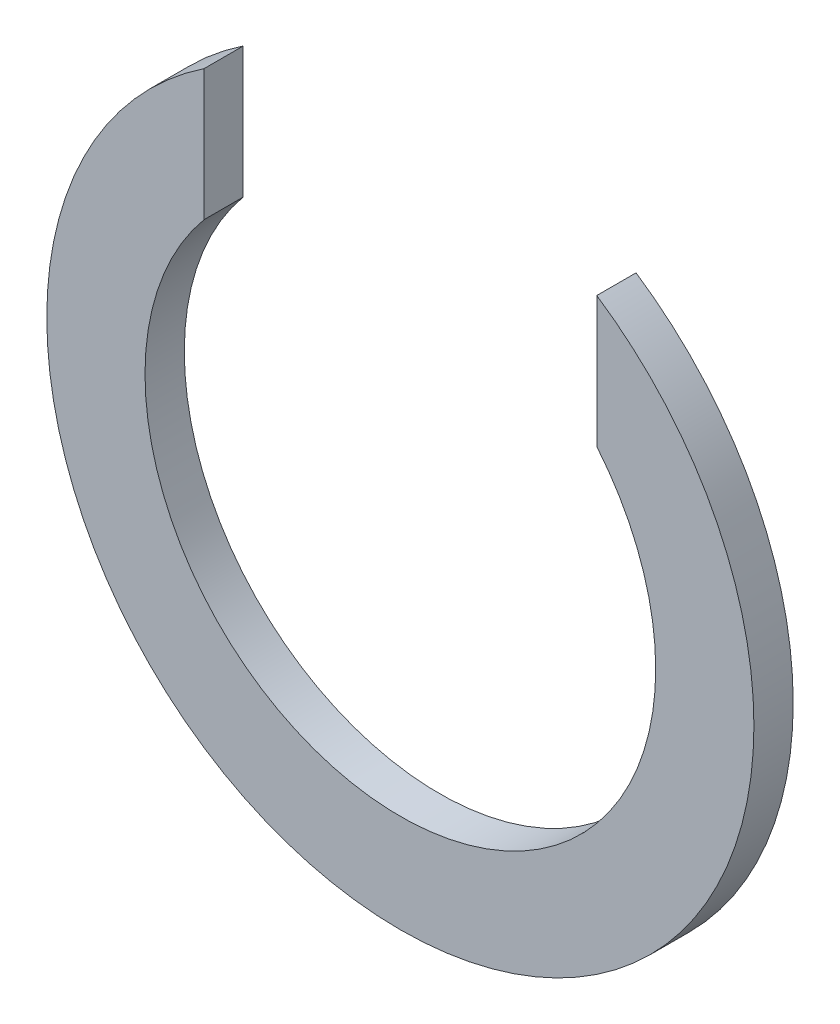
from build123d import *

# Parameters (mm, degrees)
RESSALTO_EXTRUS_O1_DEPTH = 2


with BuildPart() as part:
    # Esboço1 → Ressalto-extrusão1 (new body)
    with BuildSketch(Plane.XY):
        with BuildLine():
            Line((-10, 8.306623863), (-10, 14.966629547))
            ThreePointArc((-10, 14.966629547), (0, -18), (10, 14.966629547))
            Line((10, 14.966629547), (10, 8.306623863))
            ThreePointArc((10, 8.306623863), (0, -13), (-10, 8.306623863))
        make_face()
    extrude(amount=RESSALTO_EXTRUS_O1_DEPTH)


solid = part.part
